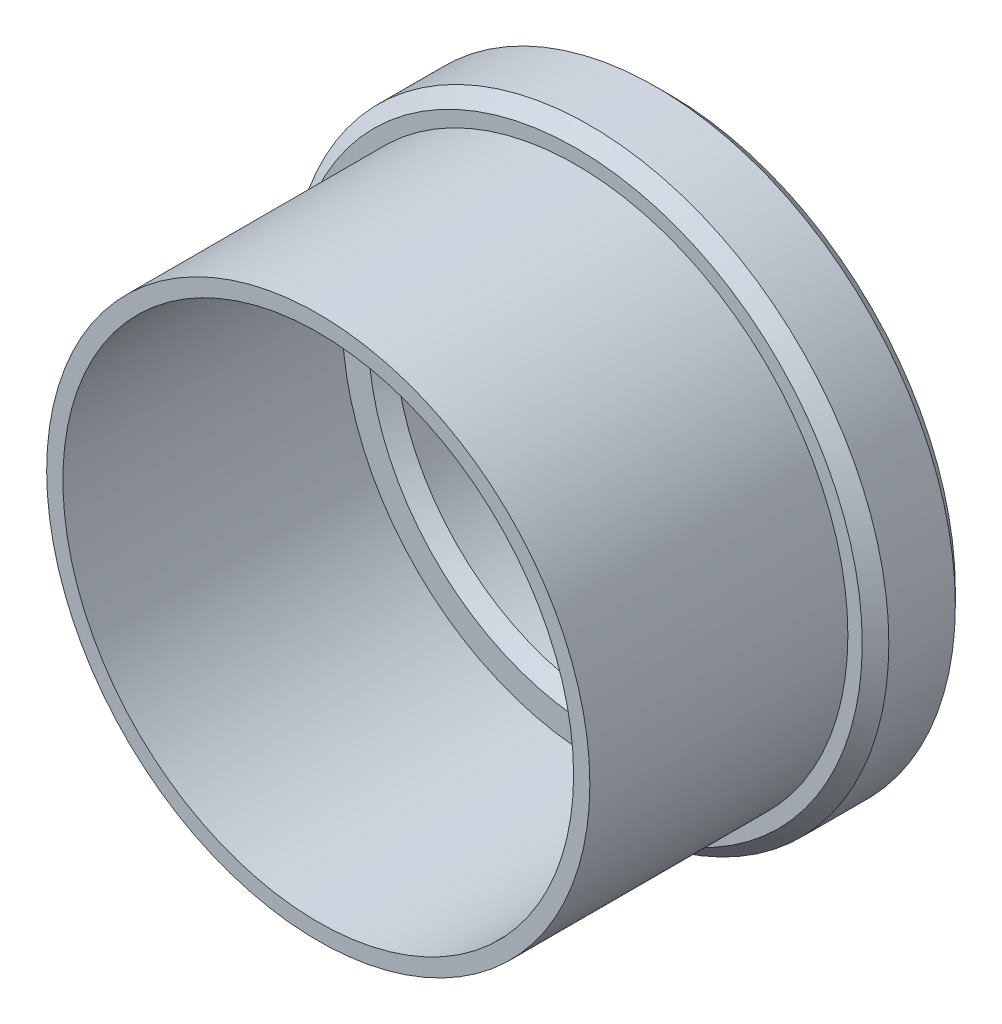
from build123d import *


with BuildPart() as part:
    # Croquis1 → Revolución1 (revolve)
    with BuildSketch(Plane(origin=(0, 0, 0), x_dir=(0, 0, -1), z_dir=(1, 0, 0)), mode=Mode.PRIVATE) as revoluci_n1_sk:
        Polygon((0, 9.6), (10.5, 9.6), (10.5, 8.625), (11, 8.125), (13.2, 8.125), (13.2, 10.75), (12.7, 11.25), (10.2, 11.25), (9.7, 10.75), (9.7, 10.21), (0, 10.21), align=None)
    revolve(revoluci_n1_sk.sketch.rotate(Axis((0, 0, 0), (0, 0, -1)), 90), axis=Axis((0, 0, 0), (0, 0, -1)))


solid = part.part
